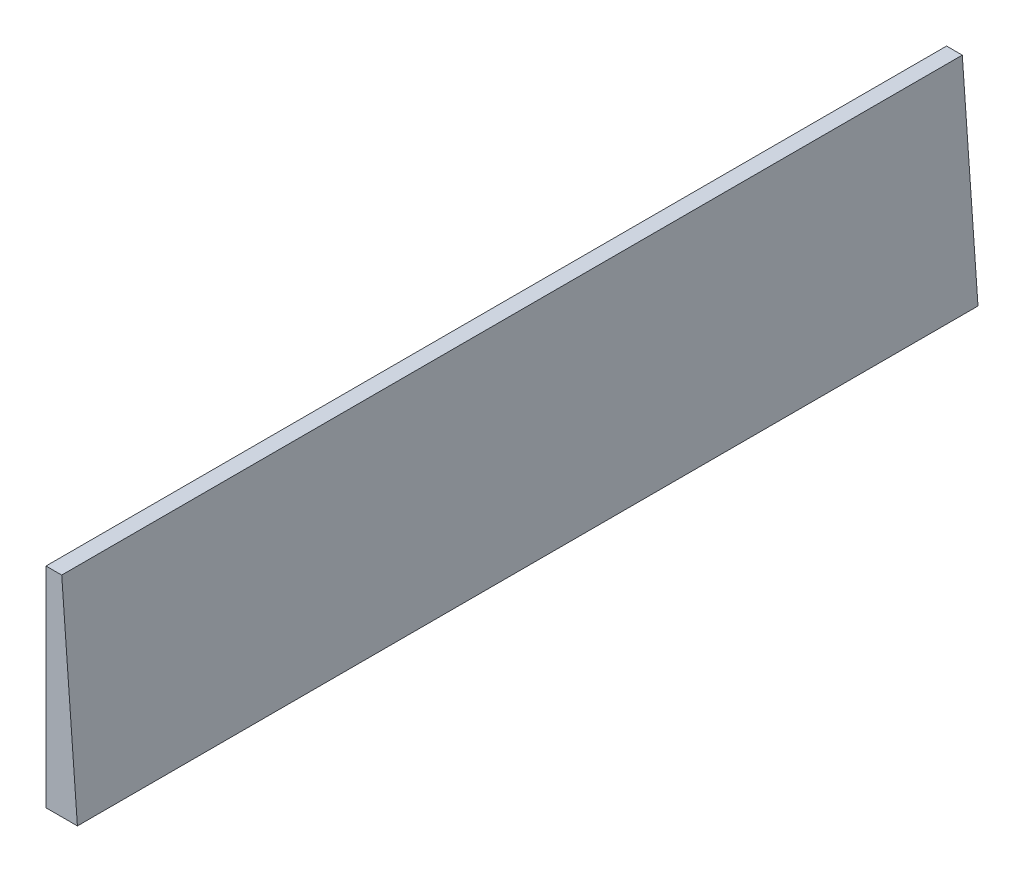
from build123d import *

# Parameters (mm, degrees)
BOSS_EXTRUDE1_DEPTH      = 4300
BOSS_EXTRUDE1_DEPTH_BACK = 4300


with BuildPart() as part:
    # Sketch1 → Boss-Extrude1 (new, two sides: drawn at the far end of the back side and taken through both)
    with BuildSketch(Plane.XY.offset(-BOSS_EXTRUDE1_DEPTH_BACK)):
        Polygon((0, 0), (0, 1000), (150, 1000), (300, -1000), (0, -1000), align=None)
    extrude(amount=BOSS_EXTRUDE1_DEPTH + BOSS_EXTRUDE1_DEPTH_BACK)


solid = part.part
